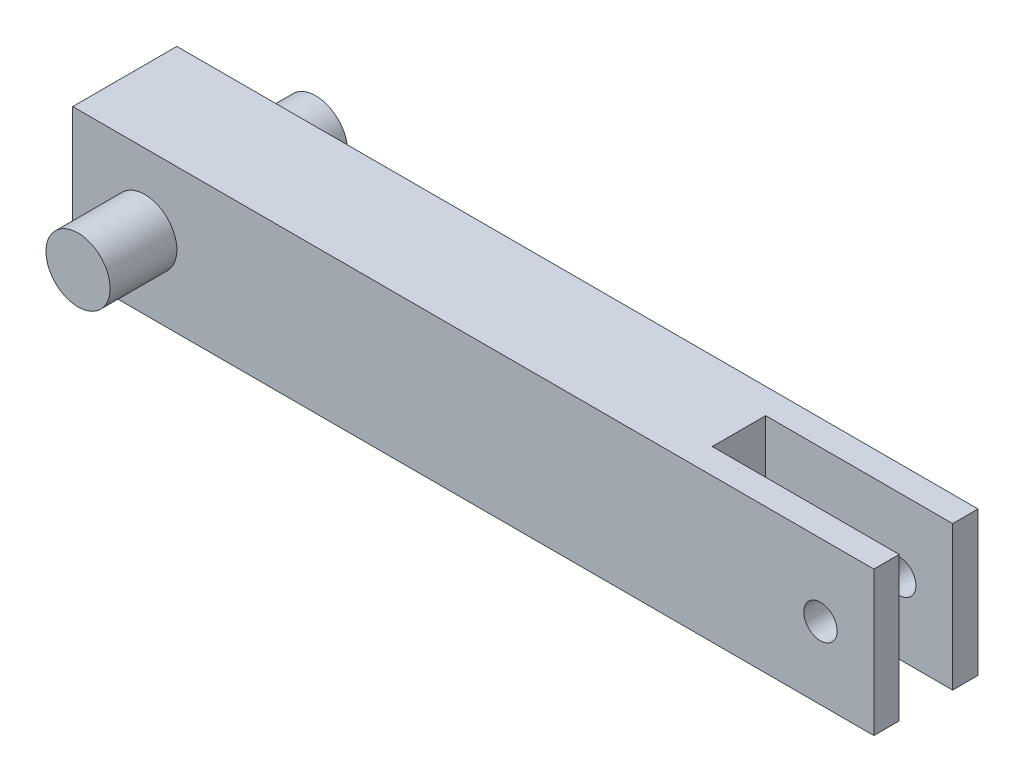
from build123d import *

# Parameters (mm, degrees)
SKETCH1_W           = 600
SKETCH1_H           = 78
BOSS_EXTRUDE1_DEPTH = 108
SKETCH2_R           = 24
BOSS_EXTRUDE2_DEPTH = 50
BOSS_EXTRUDE3_START = 50
SKETCH3_R           = 24
BOSS_EXTRUDE3_DEPTH = 50
SKETCH4_W           = 140
SKETCH4_H           = 40
CUT_EXTRUDE1_DEPTH  = 332.036251791
SKETCH5_R           = 12.5
CUT_EXTRUDE2_DEPTH  = 344.581140344


with BuildPart() as part:
    # Sketch1 → Boss-Extrude1 (new body)
    with BuildSketch(Plane(origin=(0, 0, 0), x_dir=(1, 0, 0), z_dir=(0, 1, 0))):
        Rectangle(SKETCH1_W, SKETCH1_H)
    extrude(amount=BOSS_EXTRUDE1_DEPTH)

    # Sketch2 → Boss-Extrude2 (add)
    with BuildSketch(Plane.XY.offset(39)):
        with Locations(Location((-246, 54, 0), (0, 0, 180))):
            Circle(SKETCH2_R)
    extrude(amount=BOSS_EXTRUDE2_DEPTH)

    # Sketch3 → Boss-Extrude3 (add)
    with BuildSketch(Plane(origin=(0, 0, -39), x_dir=(-1, 0, 0), z_dir=(0, 0, -1)).offset(BOSS_EXTRUDE3_START)):
        with Locations((246, 54)):
            Circle(SKETCH3_R)
    extrude(amount=-BOSS_EXTRUDE3_DEPTH)

    # Sketch4 → Cut-Extrude1 (cut, through all)
    with BuildSketch(Plane(origin=(0, 0, 0), x_dir=(-1, 0, 0), z_dir=(0, -1, 0))):
        with Locations((-230, 0)):
            Rectangle(SKETCH4_W, SKETCH4_H)
    extrude(amount=-CUT_EXTRUDE1_DEPTH, mode=Mode.SUBTRACT)

    # Sketch5 → Cut-Extrude2 (cut, through all)
    with BuildSketch(Plane(origin=(0, 0, -39), x_dir=(-1, 0, 0), z_dir=(0, 0, -1))):
        with Locations((-260, 54)):
            Circle(SKETCH5_R)
    extrude(amount=-CUT_EXTRUDE2_DEPTH, mode=Mode.SUBTRACT)


solid = part.part
